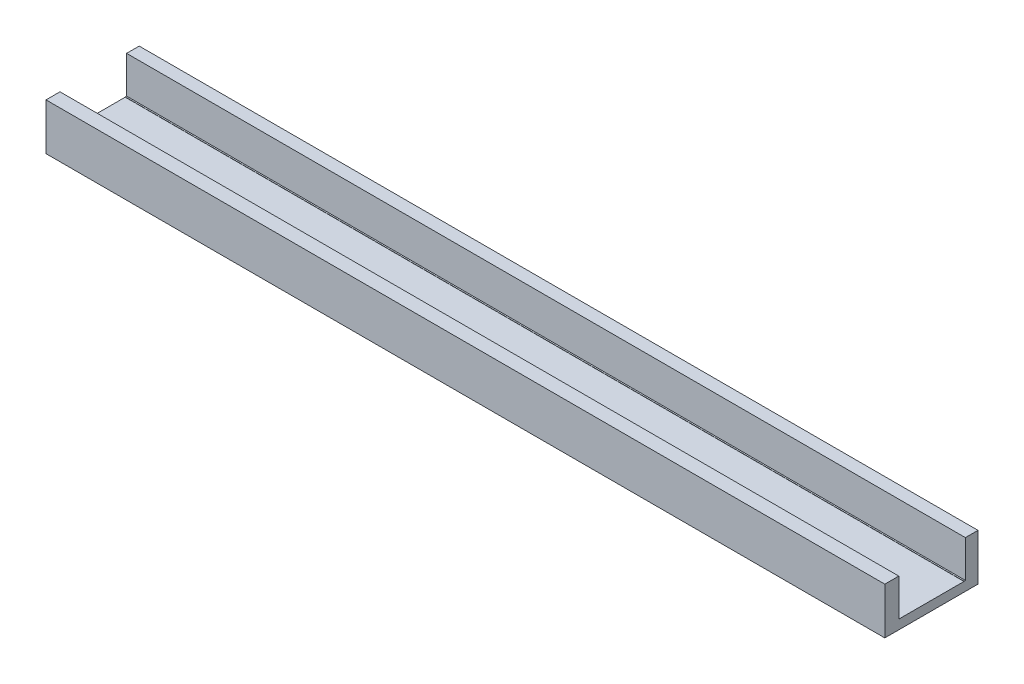
from build123d import *

# Parameters (mm, degrees)
ESQUISSE1_W             = 1800
ESQUISSE1_H             = 100
BOSS_EXTRU_1_DEPTH      = 200
ESQUISSE2_W             = 1800
ESQUISSE2_H             = 140
ENL_V_MAT_EXTRU_1_DEPTH = 80
ESQUISSE4_W             = 1800
ESQUISSE4_H             = 2.941473276
ENL_V_MAT_EXTRU_2_DEPTH = 79.5


with BuildPart() as part:
    # Esquisse1 → Boss.-Extru.1 (new body)
    with BuildSketch(Plane.XY):
        with Locations((0, -50)):
            Rectangle(ESQUISSE1_W, ESQUISSE1_H)
    extrude(amount=BOSS_EXTRU_1_DEPTH)

    # Esquisse2 → Enlèv. mat.-Extru.1 (cut)
    with BuildSketch(Plane(origin=(0, 0, 0), x_dir=(1, 0, 0), z_dir=(0, 1, 0))):
        with Locations((0, -100)):
            Rectangle(ESQUISSE2_W, ESQUISSE2_H)
    extrude(amount=-ENL_V_MAT_EXTRU_1_DEPTH, mode=Mode.SUBTRACT)

    # Esquisse4 → Enlèv. mat.-Extru.2 (cut)
    with BuildSketch(Plane(origin=(0, 0, 0), x_dir=(1, 0, 0), z_dir=(0, 1, 0))):
        with Locations((0, -28.529263362)):
            Rectangle(ESQUISSE4_W, ESQUISSE4_H)
    extrude(amount=-ENL_V_MAT_EXTRU_2_DEPTH, mode=Mode.SUBTRACT)


solid = part.part
